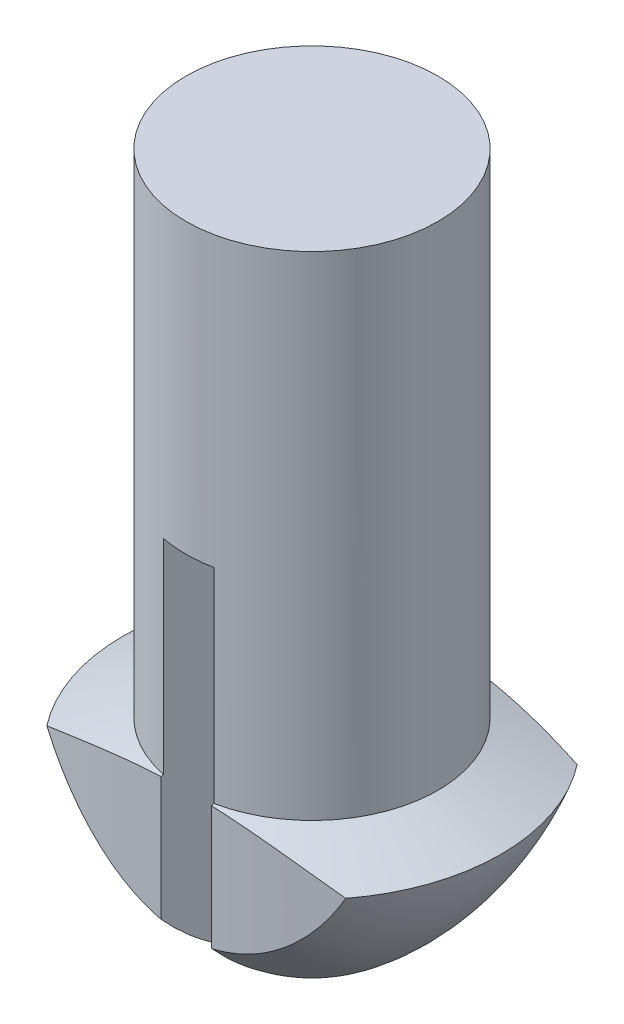
from build123d import *

# Parameters (mm, degrees)
CUT_EXTRUDE1_DEPTH      = 25.4
CUT_EXTRUDE1_DEPTH_BACK = 25.4
SKETCH2_W               = 0.4
SKETCH2_H               = 3.312305011
SKETCH3_RX              = 25.4
SKETCH3_RY              = 25.4
SKETCH3_RX_2            = 3
SKETCH3_RY_2            = 1
CUT_EXTRUDE2_DEPTH      = 50.8


with BuildPart() as part:
    # Sketch1 → Revolve1 (revolve)
    with BuildSketch(Plane.XY):
        with BuildLine():
            Line((11.742340523, -25.572268789), (11.742340523, -27.072268789))
            ThreePointArc((11.742340523, -27.072268789), (12.653410715, -26.483338981), (13.242340523, -25.572268789))
            Line((13.242340523, -25.572268789), (12.742340523, -25.382750908))
            Line((12.742340523, -25.382750908), (12.742340523, -21.472268789))
            Line((12.742340523, -21.472268789), (11.742340523, -21.472268789))
            Line((11.742340523, -21.472268789), (11.742340523, -25.572268789))
        make_face()
    revolve(axis=Axis((11.742340523, -21.472268789, 0), (0, -1, 0)))

    # Sketch2 → Cut-Extrude1 (cut, two sides: drawn at the far end of the back side and taken through both)
    with BuildSketch(Plane.XY.offset(-CUT_EXTRUDE1_DEPTH_BACK)):
        with Locations((11.742340523, -25.416116284)):
            Rectangle(SKETCH2_W, SKETCH2_H)
    extrude(amount=CUT_EXTRUDE1_DEPTH + CUT_EXTRUDE1_DEPTH_BACK, mode=Mode.SUBTRACT)

    # Sketch3 → Cut-Extrude2 (cut)
    with BuildSketch(Plane(origin=(0, 0, 0), x_dir=(1, 0, 0), z_dir=(0, 1, 0))):
        with Locations((11.742340523, 0)):
            Ellipse(SKETCH3_RX, SKETCH3_RY)
        with Locations((11.742340523, 0)):
            Ellipse(SKETCH3_RX_2, SKETCH3_RY_2, mode=Mode.SUBTRACT)
    extrude(amount=-CUT_EXTRUDE2_DEPTH, mode=Mode.SUBTRACT)


solid = part.part
